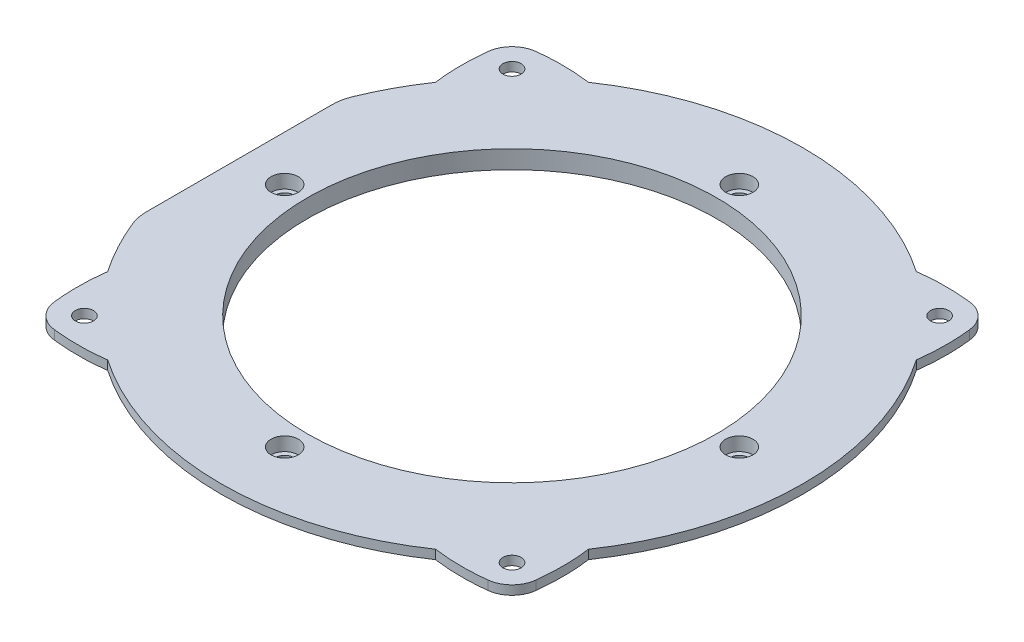
from build123d import *

# Parameters (mm, degrees)
SKETCH_1_R               = 55
SKETCH_1_R_2             = 45
EXTRUDE_1_DEPTH          = 4
EXTRUDE_START            = -4
SKETCH_2_R               = 64
SKETCH_2_R_2             = 55
EXTRUDE_2_DEPTH          = 2
SKETCH_3_R               = 3
CUT_EXTRUDE_1_DEPTH      = 3
PATTERN_CIRCULAR_1_COUNT = 4
SKETCH_4_R               = 2
CUT_EXTRUDE_2_DEPTH      = 91.559372789
PATTERN_CIRCULAR_2_COUNT = 4
SKETCH_5_R               = 2
EXTRUDE_3_DEPTH          = 2
CUT_EXTRUDE_3_DEPTH      = 91.598013365
CUT_EXTRUDE_3_DEPTH_BACK = 91.598013365
FILLET_1_R               = 10


with BuildPart() as part:
    # 草图1 → 凸台-拉伸1 (new body)
    with BuildSketch(Plane(origin=(0, 0, 0), x_dir=(1, 0, 0), z_dir=(0, 1, 0))):
        with Locations(Location((0, 0, 0), (0, 0, 270))):
            Circle(SKETCH_1_R)
        with Locations(Location((0, 0, 0), (0, 0, 270))):
            Circle(SKETCH_1_R_2, mode=Mode.SUBTRACT)
    extrude(amount=-EXTRUDE_1_DEPTH)

    # 草图2 → 凸台-拉伸2 (add)
    with BuildSketch(Plane(origin=(0, -4, 0), x_dir=(-1, 0, 0), z_dir=(0, -1, 0)).offset(EXTRUDE_START)):
        with Locations(Location((0, 0, 0), (0, 0, 90))):
            Circle(SKETCH_2_R)
        with Locations(Location((0, 0, 0), (0, 0, 270))):
            Circle(SKETCH_2_R_2, mode=Mode.SUBTRACT)
    extrude(amount=EXTRUDE_2_DEPTH)

    # 草图3 → 切除-拉伸1 (cut)
    with BuildSketch(Plane(origin=(0, 0, 0), x_dir=(1, 0, 0), z_dir=(0, 1, 0))):
        with Locations(Location((0, 50, 0), (0, 0, 270))):
            Circle(SKETCH_3_R)
    cut_extrude_1 = extrude(amount=-CUT_EXTRUDE_1_DEPTH, mode=Mode.SUBTRACT)

    # 阵列(圆周)1: 切除-拉伸1 ×4 about axis
    pattern_circular_1_axis = Axis((0, 0, 0), (0, 1, 0))
    for i in range(1, PATTERN_CIRCULAR_1_COUNT):
        add(cut_extrude_1.rotate(pattern_circular_1_axis, i * 360 / PATTERN_CIRCULAR_1_COUNT), mode=Mode.SUBTRACT)

    # 草图4 → 切除-拉伸2 (cut, through all)
    with BuildSketch(Plane(origin=(0, -3, 0), x_dir=(1, 0, 0), z_dir=(0, 1, 0))):
        with Locations(Location((0, 50, 0), (0, 0, 270))):
            Circle(SKETCH_4_R)
    cut_extrude_2 = extrude(amount=-CUT_EXTRUDE_2_DEPTH, mode=Mode.SUBTRACT)

    # 阵列(圆周)2: 切除-拉伸2 ×4 about axis
    pattern_circular_2_axis = Axis((0, 0, 0), (0, 1, 0))
    for i in range(1, PATTERN_CIRCULAR_2_COUNT):
        add(cut_extrude_2.rotate(pattern_circular_2_axis, i * 360 / PATTERN_CIRCULAR_2_COUNT), mode=Mode.SUBTRACT)

    # 草图5 → 凸台-拉伸3 (add)
    # profile 1 of 4: a face of its own
    with BuildSketch(Plane(origin=(0, 0, 0), x_dir=(1, 0, 0), z_dir=(0, 1, 0))):
        with BuildLine():
            ThreePointArc((47.70579193, 52.971441059), (51.25436151, 51.25436151), (52.971441059, 47.70579193))
            add(Edge.make_bspline(
                [(52.875879568, 36.057473011), (53.400264575, 39.842208211), (53.419874183, 43.855270087), (52.971441059, 47.70579193)],
                knots=[0, 0, 0, 0, 0.718259979, 0.718259979, 0.718259979, 0.718259979], degree=3))
            ThreePointArc((52.875879568, 36.057473011), (45.254833996, 45.254833996), (36.057473011, 52.875879568))
            add(Edge.make_bspline(
                [(36.057473011, 52.875879568), (39.842208211, 53.400264575), (43.855270087, 53.419874183), (47.70579193, 52.971441059)],
                knots=[0, 0, 0, 0, 0.718259979, 0.718259979, 0.718259979, 0.718259979], degree=3))
        make_face()
        with Locations(Location((47.022600949, 47.022600949, 0), (0, 0, 270))):
            Circle(SKETCH_5_R, mode=Mode.SUBTRACT)
    # profile 2 of 4: a face of its own
    with BuildSketch(Plane(origin=(0, 0, 0), x_dir=(1, 0, 0), z_dir=(0, 1, 0))):
        with BuildLine():
            ThreePointArc((52.971441059, -47.70579193), (51.25436151, -51.25436151), (47.70579193, -52.971441059))
            add(Edge.make_bspline(
                [(36.057473011, -52.875879568), (39.842208211, -53.400264575), (43.855270087, -53.419874183), (47.70579193, -52.971441059)],
                knots=[0, 0, 0, 0, 0.718259979, 0.718259979, 0.718259979, 0.718259979], degree=3))
            ThreePointArc((36.057473011, -52.875879568), (45.254833996, -45.254833996), (52.875879568, -36.057473011))
            add(Edge.make_bspline(
                [(52.875879568, -36.057473011), (53.400264575, -39.842208211), (53.419874183, -43.855270087), (52.971441059, -47.70579193)],
                knots=[0, 0, 0, 0, 0.718259979, 0.718259979, 0.718259979, 0.718259979], degree=3))
        make_face()
        with Locations(Location((47.022600949, -47.022600949, 0), (0, 0, 270))):
            Circle(SKETCH_5_R, mode=Mode.SUBTRACT)
    # profile 3 of 4: a face of its own
    with BuildSketch(Plane(origin=(0, 0, 0), x_dir=(1, 0, 0), z_dir=(0, 1, 0))):
        with BuildLine():
            ThreePointArc((-47.70579193, -52.971441059), (-51.25436151, -51.25436151), (-52.971441059, -47.70579193))
            add(Edge.make_bspline(
                [(-52.875879568, -36.057473011), (-53.400264576, -39.842208211), (-53.419874183, -43.855270087), (-52.971441059, -47.70579193)],
                knots=[0, 0, 0, 0, 0.718259979, 0.718259979, 0.718259979, 0.718259979], degree=3))
            ThreePointArc((-52.875879568, -36.057473011), (-45.254833996, -45.254833996), (-36.057473011, -52.875879568))
            add(Edge.make_bspline(
                [(-36.057473011, -52.875879568), (-39.842208211, -53.400264575), (-43.855270087, -53.419874183), (-47.70579193, -52.971441059)],
                knots=[0, 0, 0, 0, 0.718259979, 0.718259979, 0.718259979, 0.718259979], degree=3))
        make_face()
        with Locations(Location((-47.022600949, -47.022600949, 0), (0, 0, 270))):
            Circle(SKETCH_5_R, mode=Mode.SUBTRACT)
    # profile 4 of 4: a face of its own
    with BuildSketch(Plane(origin=(0, 0, 0), x_dir=(1, 0, 0), z_dir=(0, 1, 0))):
        with BuildLine():
            ThreePointArc((-52.971441059, 47.70579193), (-51.25436151, 51.25436151), (-47.70579193, 52.971441059))
            add(Edge.make_bspline(
                [(-36.057473011, 52.875879568), (-39.842208211, 53.400264576), (-43.855270087, 53.419874183), (-47.70579193, 52.971441059)],
                knots=[0, 0, 0, 0, 0.718259979, 0.718259979, 0.718259979, 0.718259979], degree=3))
            ThreePointArc((-36.057473011, 52.875879568), (-45.254833996, 45.254833996), (-52.875879568, 36.057473011))
            add(Edge.make_bspline(
                [(-52.875879568, 36.057473011), (-53.400264575, 39.842208211), (-53.419874183, 43.855270087), (-52.971441059, 47.70579193)],
                knots=[0, 0, 0, 0, 0.718259979, 0.718259979, 0.718259979, 0.718259979], degree=3))
        make_face()
        with Locations(Location((-47.022600949, 47.022600949, 0), (0, 0, 270))):
            Circle(SKETCH_5_R, mode=Mode.SUBTRACT)
    extrude(amount=-EXTRUDE_3_DEPTH)

    # 草图6 → 切除-拉伸3 (cut, two sides: drawn at the far end of the back side and taken through both)
    with BuildSketch(Plane(origin=(0, 0, 0), x_dir=(1, 0, 0), z_dir=(0, 1, 0)).offset(-CUT_EXTRUDE_3_DEPTH_BACK)):
        Polygon((-60, 26.714394046), (-60, -26.64509416), (-76.414310547, -26.64509416), (-74.893876556, 32.809859769), align=None)
    extrude(amount=CUT_EXTRUDE_3_DEPTH + CUT_EXTRUDE_3_DEPTH_BACK, mode=Mode.SUBTRACT)

    # 圆角1
    fillet_1_edges = [part.edges().sort_by_distance(p)[0] for p in [
        (-60, -1, 22.271057451),
        (-60, -1, -22.271057451),
    ]]
    fillet(fillet_1_edges, radius=FILLET_1_R)


solid = part.part
